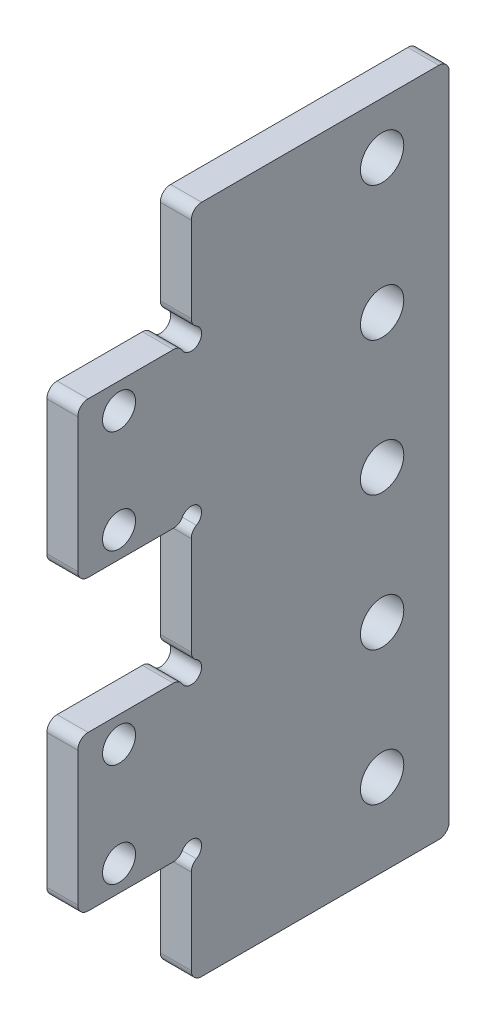
from build123d import *

# Parameters (mm, degrees)
SKETCH_1_W          = 28
SKETCH_1_H          = 65
EXTRUDE_1_DEPTH     = 3
SKETCH_2_W          = 3
SKETCH_2_H          = 11
SKETCH_2_H_2        = 13
CUT_EXTRUDE_1_DEPTH = 71.837842994
SKETCH_3_R          = 2.1
CUT_EXTRUDE_2_DEPTH = 71.837842994
SKETCH_4_R          = 1
CUT_EXTRUDE_3_DEPTH = 71.837842994
SKETCH_5_W          = 3
SKETCH_5_H          = 15
EXTRUDE_2_DEPTH     = 8
SKETCH_6_R          = 1.6
CUT_EXTRUDE_4_DEPTH = 10
FILLET_1_R          = 1


with BuildPart() as part:
    # 草图1 → 凸台-拉伸1 (new body)
    with BuildSketch(Plane(origin=(0, 0, 0), x_dir=(0, 0, -1), z_dir=(1, 0, 0))):
        with Locations((14, 32.5)):
            Rectangle(SKETCH_1_W, SKETCH_1_H)
    extrude(amount=EXTRUDE_1_DEPTH)

    # 草图2 → 切除-拉伸1 (cut, through all)
    with BuildSketch(Plane(origin=(3, 0, 0), x_dir=(0, 0, -1), z_dir=(1, 0, 0))):
        with Locations((1.5, 59.5)):
            Rectangle(SKETCH_2_W, SKETCH_2_H)
        with Locations((1.5, 32.5)):
            Rectangle(SKETCH_2_W, SKETCH_2_H_2)
        with Locations((1.5, 5.5)):
            Rectangle(SKETCH_2_W, SKETCH_2_H)
    extrude(amount=-CUT_EXTRUDE_1_DEPTH, mode=Mode.SUBTRACT)

    # 草图3 → 切除-拉伸2 (cut, through all)
    with BuildSketch(Plane(origin=(3, 0, 0), x_dir=(0, 0, -1), z_dir=(1, 0, 0))):
        with Locations((21.5, 60)):
            Circle(SKETCH_3_R)
        with Locations((21.5, 47)):
            Circle(SKETCH_3_R)
        with Locations((21.5, 34)):
            Circle(SKETCH_3_R)
        with Locations((21.5, 21)):
            Circle(SKETCH_3_R)
        with Locations((21.5, 8)):
            Circle(SKETCH_3_R)
    extrude(amount=-CUT_EXTRUDE_2_DEPTH, mode=Mode.SUBTRACT)

    # 草图4 → 切除-拉伸3 (cut, through all)
    with BuildSketch(Plane(origin=(3, 0, 0), x_dir=(0, 0, -1), z_dir=(1, 0, 0))):
        with Locations((3, 54)):
            Circle(SKETCH_4_R)
        with Locations((3, 39)):
            Circle(SKETCH_4_R)
        with Locations((3, 26)):
            Circle(SKETCH_4_R)
        with Locations((3, 11)):
            Circle(SKETCH_4_R)
    extrude(amount=-CUT_EXTRUDE_3_DEPTH, mode=Mode.SUBTRACT)

    # 草图5 → 凸台-拉伸2 (add)
    with BuildSketch(Plane.XY):
        with Locations((1.5, 18.5)):
            Rectangle(SKETCH_5_W, SKETCH_5_H)
        with Locations((1.5, 46.5)):
            Rectangle(SKETCH_5_W, SKETCH_5_H)
    extrude(amount=EXTRUDE_2_DEPTH)

    # 草图6 → 切除-拉伸4 (cut)
    with BuildSketch(Plane(origin=(3, 0, 0), x_dir=(0, 0, -1), z_dir=(1, 0, 0))):
        with Locations((-4, 51.5)):
            Circle(SKETCH_6_R)
        with Locations((-4, 41.5)):
            Circle(SKETCH_6_R)
        with Locations((-4, 23.5)):
            Circle(SKETCH_6_R)
        with Locations((-4, 13.5)):
            Circle(SKETCH_6_R)
    extrude(amount=-CUT_EXTRUDE_4_DEPTH, mode=Mode.SUBTRACT)

    # 圆角1
    fillet_1_edges = [part.edges().sort_by_distance(p)[0] for p in [
        (1.5, 39, -2),
        (1.5, 27, -3),
        (1.5, 11, -2),
        (1.5, 11, 8),
        (1.5, 26, 8),
        (1.5, 39, 8),
        (1.5, 54, 8),
        (1.5, 65, -3),
        (1.5, 0, -3),
        (1.5, 65, -28),
        (1.5, 0, -28),
        (1.5, 54, -2),
        (1.5, 26, -2),
        (1.5, 38, -3),
        (1.5, 10, -3),
        (1.5, 55, -3),
    ]]
    fillet(fillet_1_edges, radius=FILLET_1_R)


solid = part.part
